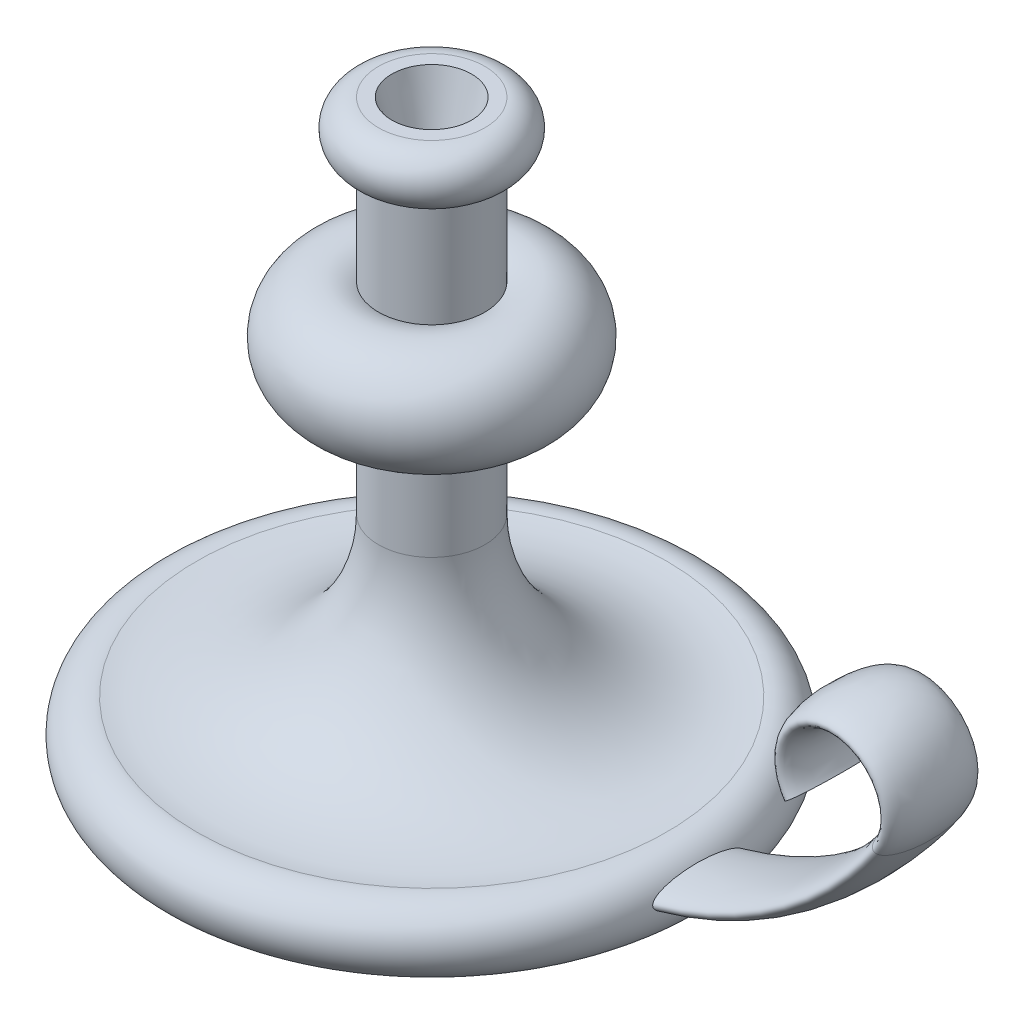
from build123d import *

# Parameters (mm, degrees)
SKETCH3_RX         = 17.5
SKETCH3_RY         = 5
SKETCH4_R          = 15
CUT_EXTRUDE1_DEPTH = 25
CUT_EXTRUDE1_DRAFT = -15


with BuildPart() as part:
    # Sketch1 → Revolve1 (revolve)
    with BuildSketch(Plane.XY, mode=Mode.PRIVATE) as revolve1_sk:
        with BuildLine():
            Line((0, 0), (90, 0))
            ThreePointArc((90, 0), (102.470094964, 13.364136328), (88.275862069, 24.880522945))
            ThreePointArc((88.275862069, 24.880522945), (40.608070142, 39.049151314), (20, 84.307033082))
            Line((20, 84.307033082), (20, 124.307033082))
            ThreePointArc((20, 124.307033082), (49.027902754, 142.153516541), (20, 160))
            Line((20, 160), (20, 200))
            ThreePointArc((20, 200), (30, 210), (20, 220))
            Line((20, 220), (0, 220))
            Line((0, 220), (0, 0))
        make_face()
    revolve(revolve1_sk.sketch.rotate(Axis((0, 0, 0), (0, 1, 0)), 90), axis=Axis((0, 0, 0), (0, 1, 0)))

    # Sweep1: sweep along a path in Sketch2
    with BuildLine(Plane.XY) as sweep1_path:
        Line((0, 10), (60, 10))
        ThreePointArc((60, 10), (129.821200219, 27.240819526), (183.592070943, 75))
        ThreePointArc((183.592070943, 75), (167.113128151, 106.333333333), (150.634185358, 75))
    # Sketch3 → Sweep1 (sweep)
    with BuildSketch(Plane(origin=(0, 0, 0), x_dir=(0, 0, -1), z_dir=(1, 0, 0))):
        with Locations((0, 10)):
            Ellipse(SKETCH3_RX, SKETCH3_RY)
    sweep(path=sweep1_path.line)


with BuildPart() as cut_extrude1_tool:
    # Sketch4 → Cut-Extrude1 (with draft: the straight prism first)
    with BuildSketch(Plane(origin=(0, 220, 0), x_dir=(1, 0, 0), z_dir=(0, 1, 0))):
        Circle(SKETCH4_R)
    extrude(amount=-CUT_EXTRUDE1_DEPTH)
    # Cut-Extrude1: the draft: its side faces are tilted about the plane it starts from
    cut_extrude1_sides = [cut_extrude1_tool.faces().sort_by_distance(p)[0] for p in [
        (-15, 207.5, 0),
    ]]
    draft(cut_extrude1_sides, Plane(origin=(0, 220, 0), x_dir=(1, 0, 0), z_dir=(0, 1, 0)), CUT_EXTRUDE1_DRAFT)


with BuildPart() as part_1:
    add(part.part)

    # Cut-Extrude1: cut by cut_extrude1_tool
    add(cut_extrude1_tool.part, mode=Mode.SUBTRACT)


solid = part_1.part
